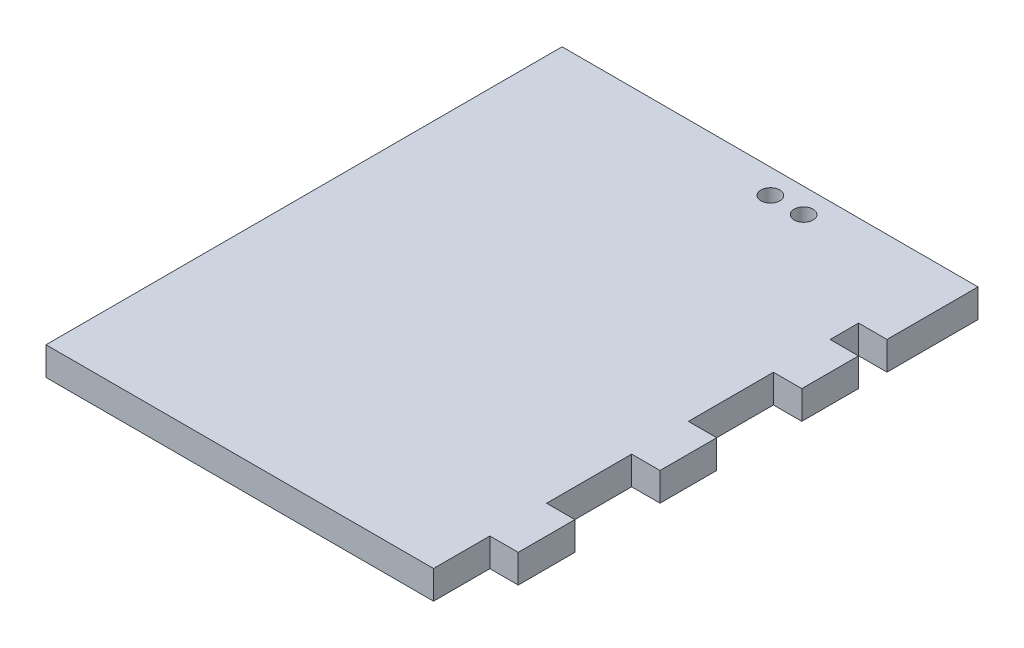
from build123d import *

# Parameters (mm, degrees)
SKETCH1_W           = 44
SKETCH1_H           = 54.6
SKETCH1_R           = 1
BOSS_EXTRUDE1_DEPTH = 3
SKETCH2_W           = 3
SKETCH2_H           = 3.011475899
SKETCH2_H_2         = 9
SKETCH2_H_3         = 5.958851055
CUT_EXTRUDE2_DEPTH  = 10


with BuildPart() as part:
    # Sketch1 → Boss-Extrude1 (new body)
    with BuildSketch(Plane(origin=(0, 0, 0), x_dir=(1, 0, 0), z_dir=(0, 1, 0))):
        Rectangle(SKETCH1_W, SKETCH1_H)
        with Locations(Location((2.636984901, 24.7, 0), (0, 0, 270))):
            Circle(SKETCH1_R, mode=Mode.SUBTRACT)
        with Locations(Location((6.15, 24.7, 0), (0, 0, 270))):
            Circle(SKETCH1_R, mode=Mode.SUBTRACT)
    extrude(amount=BOSS_EXTRUDE1_DEPTH)

    # Sketch2 → Cut-Extrude2 (cut)
    with BuildSketch(Plane.XZ):
        with Locations((20.5, -16.164589005)):
            Rectangle(SKETCH2_W, SKETCH2_H)
        with Locations((20.5, -4.158851055)):
            Rectangle(SKETCH2_W, SKETCH2_H_2)
        with Locations((20.5, 10.841148945)):
            Rectangle(SKETCH2_W, SKETCH2_H_2)
        with Locations((20.5, 24.320574472)):
            Rectangle(SKETCH2_W, SKETCH2_H_3)
    extrude(amount=-CUT_EXTRUDE2_DEPTH, mode=Mode.SUBTRACT)


solid = part.part
